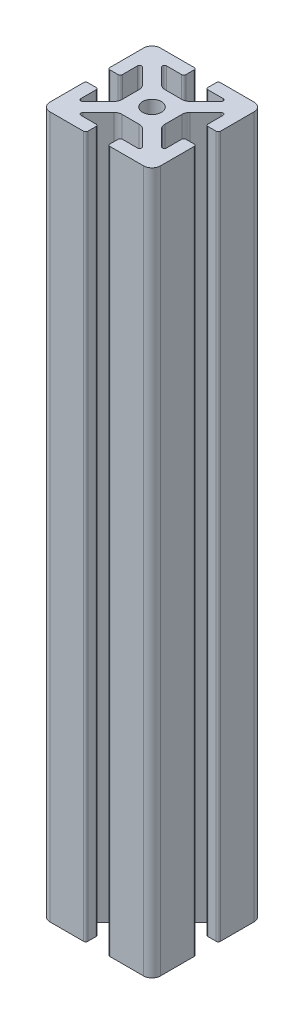
from build123d import *

# Parameters (mm, degrees)
SKETCH1_R           = 3.4036
BOSS_EXTRUDE1_DEPTH = 127


with BuildPart() as part:
    # Sketch1 → Boss-Extrude1 (new, symmetric)
    with BuildSketch(Plane(origin=(0, 0, 0), x_dir=(1, 0, 0), z_dir=(0, 1, 0))):
        with BuildLine():
            Line((-20, 16.952), (-20, 4.7625))
            ThreePointArc((-20, 4.7625), (-19.776815367, 4.223684633), (-19.238, 4.0005))
            Line((-19.238, 4.0005), (-16.2662, 4.0005))
            ThreePointArc((-16.2662, 4.0005), (-15.727384633, 4.223684633), (-15.5042, 4.7625))
            Line((-15.5042, 4.7625), (-15.5042, 10.2235))
            ThreePointArc((-15.5042, 10.2235), (-15.033804775, 10.927496204), (-14.203384633, 10.762315367))
            Line((-14.203384633, 10.762315367), (-8.635059555, 5.19399029))
            ThreePointArc((-8.635059555, 5.19399029), (-7.985348265, 4.221628629), (-7.7572, 3.074649845))
            Line((-7.7572, 3.074649845), (-7.7572, -3.074649845))
            ThreePointArc((-7.7572, -3.074649845), (-7.985348265, -4.221628629), (-8.635059555, -5.19399029))
            Line((-8.635059555, -5.19399029), (-14.203384633, -10.762315367))
            ThreePointArc((-14.203384633, -10.762315367), (-15.033804775, -10.927496204), (-15.5042, -10.2235))
            Line((-15.5042, -10.2235), (-15.5042, -4.7625))
            ThreePointArc((-15.5042, -4.7625), (-15.727384633, -4.223684633), (-16.2662, -4.0005))
            Line((-16.2662, -4.0005), (-19.238, -4.0005))
            ThreePointArc((-19.238, -4.0005), (-19.776815367, -4.223684633), (-20, -4.7625))
            Line((-20, -4.7625), (-20, -16.952))
            ThreePointArc((-20, -16.952), (-19.107261469, -19.107261469), (-16.952, -20))
            Line((-16.952, -20), (-4.7625, -20))
            ThreePointArc((-4.7625, -20), (-4.223684633, -19.776815367), (-4.0005, -19.238))
            Line((-4.0005, -19.238), (-4.0005, -16.2662))
            ThreePointArc((-4.0005, -16.2662), (-4.223684633, -15.727384633), (-4.7625, -15.5042))
            Line((-4.7625, -15.5042), (-10.2235, -15.5042))
            ThreePointArc((-10.2235, -15.5042), (-10.927496204, -15.033804775), (-10.762315367, -14.203384633))
            Line((-10.762315367, -14.203384633), (-5.19399029, -8.635059555))
            ThreePointArc((-5.19399029, -8.635059555), (-4.221628629, -7.985348265), (-3.074649845, -7.7572))
            Line((-3.074649845, -7.7572), (3.074649845, -7.7572))
            ThreePointArc((3.074649845, -7.7572), (4.221628629, -7.985348265), (5.19399029, -8.635059555))
            Line((5.19399029, -8.635059555), (10.762315367, -14.203384633))
            ThreePointArc((10.762315367, -14.203384633), (10.927496204, -15.033804775), (10.2235, -15.5042))
            Line((10.2235, -15.5042), (4.7625, -15.5042))
            ThreePointArc((4.7625, -15.5042), (4.223684633, -15.727384633), (4.0005, -16.2662))
            Line((4.0005, -16.2662), (4.0005, -19.238))
            ThreePointArc((4.0005, -19.238), (4.223684633, -19.776815367), (4.7625, -20))
            Line((4.7625, -20), (16.952, -20))
            ThreePointArc((16.952, -20), (19.107261469, -19.107261469), (20, -16.952))
            Line((20, -16.952), (20, -4.7625))
            ThreePointArc((20, -4.7625), (19.776815367, -4.223684633), (19.238, -4.0005))
            Line((19.238, -4.0005), (16.2662, -4.0005))
            ThreePointArc((16.2662, -4.0005), (15.727384633, -4.223684633), (15.5042, -4.7625))
            Line((15.5042, -4.7625), (15.5042, -10.2235))
            ThreePointArc((15.5042, -10.2235), (15.033804775, -10.927496204), (14.203384633, -10.762315367))
            Line((14.203384633, -10.762315367), (8.635059555, -5.19399029))
            ThreePointArc((8.635059555, -5.19399029), (7.985348265, -4.221628629), (7.7572, -3.074649845))
            Line((7.7572, -3.074649845), (7.7572, 3.074649845))
            ThreePointArc((7.7572, 3.074649845), (7.985348265, 4.221628629), (8.635059555, 5.19399029))
            Line((8.635059555, 5.19399029), (14.203384633, 10.762315367))
            ThreePointArc((14.203384633, 10.762315367), (15.033804775, 10.927496204), (15.5042, 10.2235))
            Line((15.5042, 10.2235), (15.5042, 4.7625))
            ThreePointArc((15.5042, 4.7625), (15.727384633, 4.223684633), (16.2662, 4.0005))
            Line((16.2662, 4.0005), (19.238, 4.0005))
            ThreePointArc((19.238, 4.0005), (19.776815367, 4.223684633), (20, 4.7625))
            Line((20, 4.7625), (20, 16.952))
            ThreePointArc((20, 16.952), (19.107261469, 19.107261469), (16.952, 20))
            Line((16.952, 20), (4.7625, 20))
            ThreePointArc((4.7625, 20), (4.223684633, 19.776815367), (4.0005, 19.238))
            Line((4.0005, 19.238), (4.0005, 16.2662))
            ThreePointArc((4.0005, 16.2662), (4.223684633, 15.727384633), (4.7625, 15.5042))
            Line((4.7625, 15.5042), (10.2235, 15.5042))
            ThreePointArc((10.2235, 15.5042), (10.927496204, 15.033804775), (10.762315367, 14.203384633))
            Line((10.762315367, 14.203384633), (5.19399029, 8.635059555))
            ThreePointArc((5.19399029, 8.635059555), (4.221628629, 7.985348265), (3.074649845, 7.7572))
            Line((3.074649845, 7.7572), (-3.074649845, 7.7572))
            ThreePointArc((-3.074649845, 7.7572), (-4.221628629, 7.985348265), (-5.19399029, 8.635059555))
            Line((-5.19399029, 8.635059555), (-10.762315367, 14.203384633))
            ThreePointArc((-10.762315367, 14.203384633), (-10.927496204, 15.033804775), (-10.2235, 15.5042))
            Line((-10.2235, 15.5042), (-4.7625, 15.5042))
            ThreePointArc((-4.7625, 15.5042), (-4.223684633, 15.727384633), (-4.0005, 16.2662))
            Line((-4.0005, 16.2662), (-4.0005, 19.238))
            ThreePointArc((-4.0005, 19.238), (-4.223684633, 19.776815367), (-4.7625, 20))
            Line((-4.7625, 20), (-16.952, 20))
            ThreePointArc((-16.952, 20), (-19.107261469, 19.107261469), (-20, 16.952))
        make_face()
        with Locations(Location((0, 0, 0), (0, 0, 270))):
            Circle(SKETCH1_R, mode=Mode.SUBTRACT)
    extrude(amount=BOSS_EXTRUDE1_DEPTH, both=True)


solid = part.part
